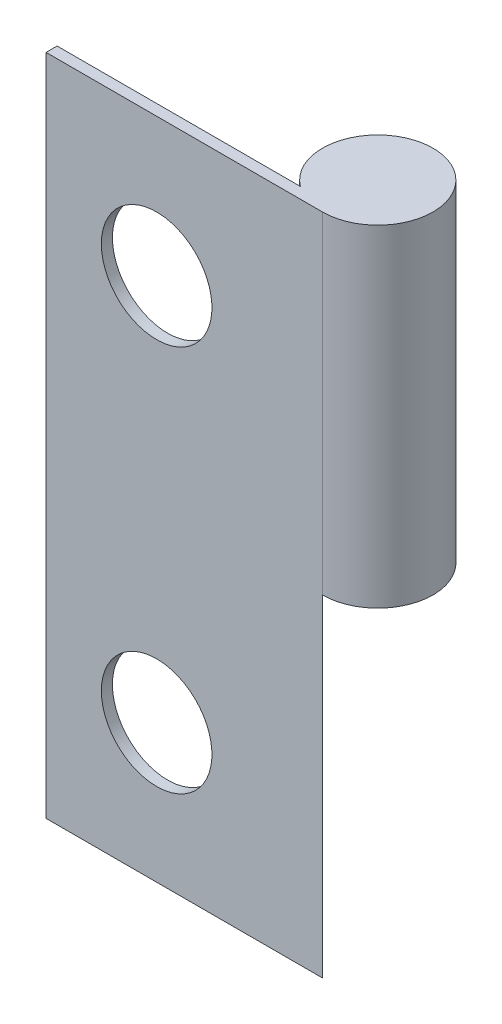
from build123d import *

# Parameters (mm, degrees)
BOSS_EXTRUDE1_DEPTH = 19.05
SKETCH1_4_R         = 1.5875
CUT_EXTRUDE2_DEPTH  = 9.525
SKETCH2_R           = 1.5875
CUT_EXTRUDE3_DEPTH  = 21.83438774


with BuildPart() as part:
    # Sketch1 → Boss-Extrude1 (new body)
    with BuildSketch(Plane(origin=(0, 0, 0), x_dir=(1, 0, 0), z_dir=(0, 1, 0))):
        with BuildLine():
            Line((-0.9525, 0.3175), (-7.9375, 0.3175))
            Line((-7.9375, 0.3175), (-7.9375, 0))
            Line((-7.9375, 0), (0, 0))
            ThreePointArc((0, 0), (0.502011579, 3.093534736), (-0.9525, 0.3175))
        make_face()
    extrude(amount=BOSS_EXTRUDE1_DEPTH)

    # Sketch1<4> → Cut-Extrude2 (cut)
    with BuildSketch(Plane(origin=(0, 0, 0), x_dir=(1, 0, 0), z_dir=(0, 1, 0))):
        with Locations((0, 1.5875)):
            Circle(SKETCH1_4_R)
    extrude(amount=CUT_EXTRUDE2_DEPTH, mode=Mode.SUBTRACT)

    # Sketch2 → Cut-Extrude3 (cut, through all)
    with BuildSketch(Plane(origin=(0, 0, -0.3175), x_dir=(-1, 0, 0), z_dir=(0, 0, -1))):
        with Locations((4.7625, 15.08125)):
            Circle(SKETCH2_R)
        with Locations((4.7625, 3.96875)):
            Circle(SKETCH2_R)
    extrude(amount=-CUT_EXTRUDE3_DEPTH, mode=Mode.SUBTRACT)


solid = part.part
